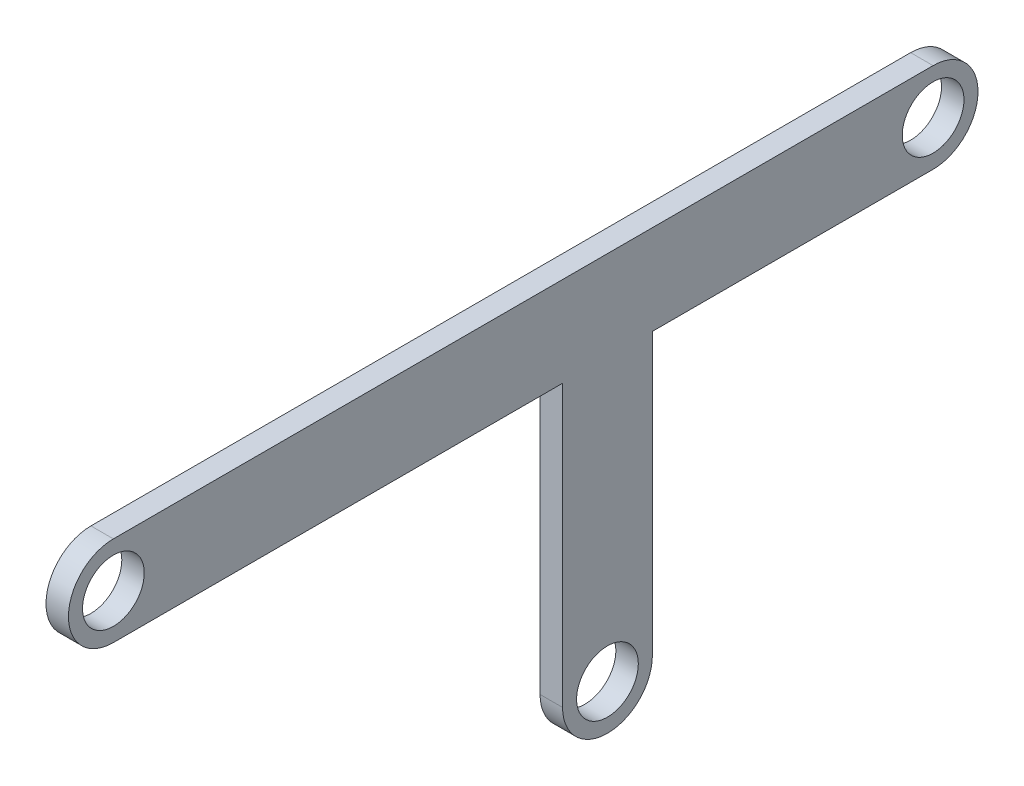
from build123d import *

# Parameters (mm, degrees)
SKETCH1_R           = 2.75
BOSS_EXTRUDE1_DEPTH = 2


with BuildPart() as part:
    # Sketch1 → Boss-Extrude1 (new body)
    with BuildSketch(Plane(origin=(0, 0, 0), x_dir=(0, 0, -1), z_dir=(1, 0, 0))):
        with BuildLine():
            Line((4, 4), (44, 4))
            Line((44, 4), (44, -21))
            ThreePointArc((44, -21), (48, -25), (52, -21))
            Line((52, -21), (52, 4))
            Line((52, 4), (77, 4))
            ThreePointArc((77, 4), (81, 8), (77, 12))
            Line((77, 12), (4, 12))
            ThreePointArc((4, 12), (0, 8), (4, 4))
        make_face()
        with Locations((4, 8)):
            Circle(SKETCH1_R, mode=Mode.SUBTRACT)
        with Locations((77, 8)):
            Circle(SKETCH1_R, mode=Mode.SUBTRACT)
        with Locations((48, -21)):
            Circle(SKETCH1_R, mode=Mode.SUBTRACT)
    extrude(amount=-BOSS_EXTRUDE1_DEPTH)


solid = part.part
